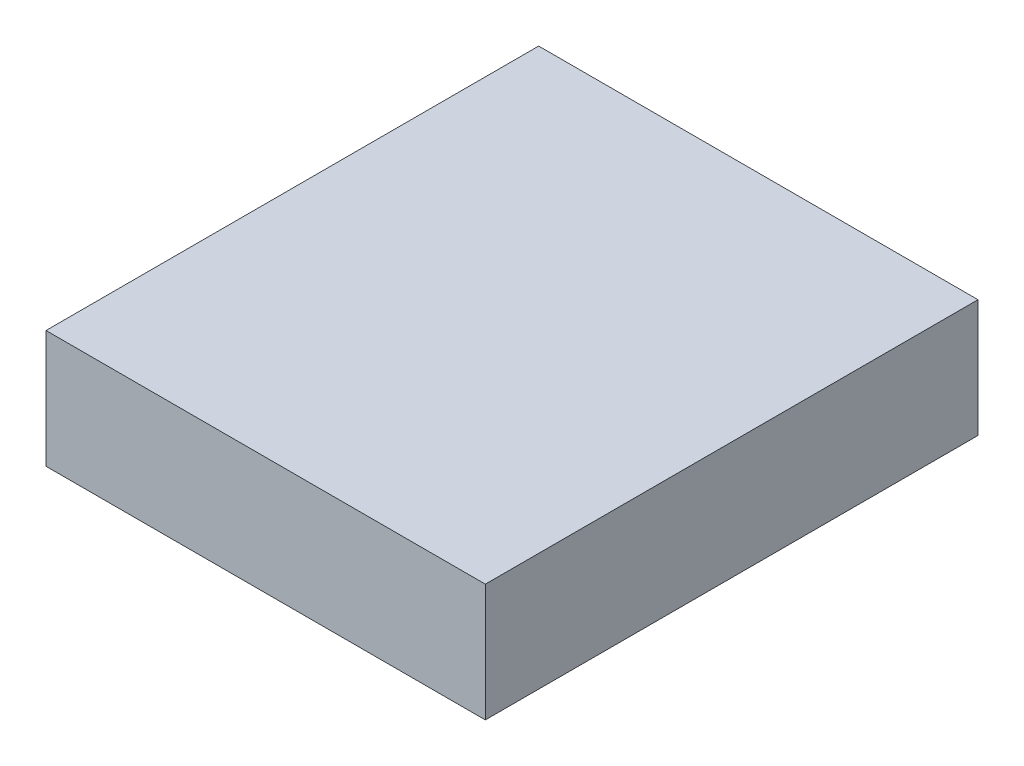
from build123d import *

# Parameters (mm, degrees)
SKETCH_1_W      = 37.35462538
SKETCH_1_H      = 41.889747785
EXTRUDE_1_DEPTH = 10


with BuildPart() as part:
    # Эскиз1 → Бобышка-Вытянуть1 (new body)
    with BuildSketch(Plane(origin=(0, 0, 0), x_dir=(1, 0, 0), z_dir=(0, 1, 0))):
        with Locations((-18.67731269, 20.944873893)):
            Rectangle(SKETCH_1_W, SKETCH_1_H)
    extrude(amount=EXTRUDE_1_DEPTH)


solid = part.part
